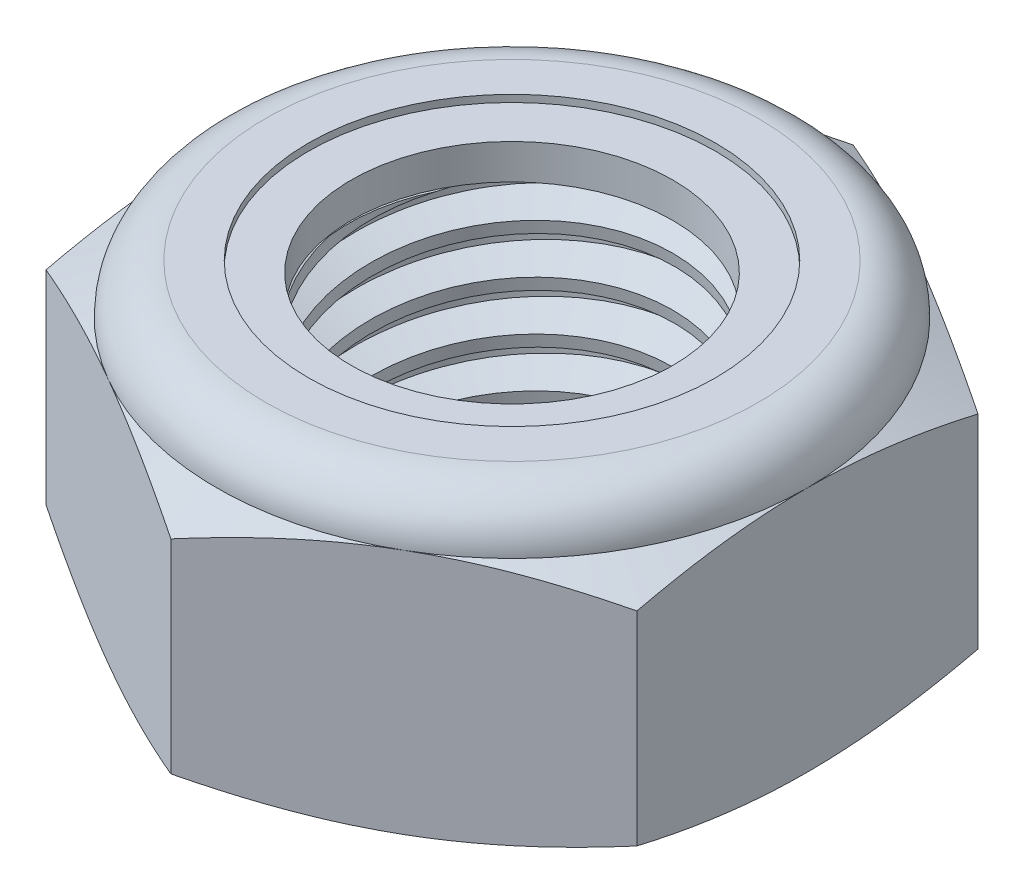
from build123d import *

# Parameters (mm, degrees)
EXTRUDE1_DEPTH      = 6.35
SKETCH2_W           = 3.9624
SKETCH2_H           = 6.35
LPATTERN1_COUNT     = 6
LPATTERN1_PITCH     = 1.058333333
LPATTERN1_COL_COUNT = 2
LPATTERN1_COL_PITCH = 1.058333333


with BuildPart() as part:
    # Sketch1 → Extrude1 (new body)
    with BuildSketch(Plane(origin=(0, 0, 0), x_dir=(1, 0, 0), z_dir=(0, 1, 0))):
        Polygon((0, 7.332348419), (-6.35, 3.666174209), (-6.35, -3.666174209), (0, -7.332348419), (6.35, -3.666174209), (6.35, 3.666174209), align=None)
    extrude(amount=EXTRUDE1_DEPTH)

    # Sketch4 → Cut-Revolve2 (revolve, cut)
    with BuildSketch(Plane(origin=(0, 0, 0), x_dir=(0, 0, -1), z_dir=(1, 0, 0)), mode=Mode.PRIVATE) as cut_revolve2_sk:
        Polygon((0, 6.35), (3.9624, 6.35), (3.4558921, 6.113811487), (3.4558921, 0.236188513), (3.9624, 0), (0, 0), align=None)
    revolve(cut_revolve2_sk.sketch.rotate(Axis((0, 6.35, 0), (0, 1, 0)), 54.857993794), axis=Axis((0, 6.35, 0), (0, 1, 0)), mode=Mode.SUBTRACT)


with BuildPart() as body_2:
    # Sketch2 → Revolve1 (revolve)
    with BuildSketch(Plane(origin=(0, 0, 0), x_dir=(0, 0, -1), z_dir=(1, 0, 0))):
        with Locations((1.9812, 3.175)):
            Rectangle(SKETCH2_W, SKETCH2_H)
    revolve(axis=Axis((0, -3.9624, 0), (0, 1, 0)))

    # Sketch3 → Cut-Revolve1 (revolve, cut)
    with BuildSketch(Plane(origin=(0, 0, 0), x_dir=(0, 0, -1), z_dir=(1, 0, 0)), mode=Mode.PRIVATE) as cut_revolve1_sk:
        Polygon((3.979911688, 6.218872482), (4.102493502, 5.300979859), (3.490915476, 5.552970821), (3.4558921, 5.815225856), align=None)
    cut_revolve1 = revolve(cut_revolve1_sk.sketch.rotate(Axis((0, 6.35, 0.150876649), (0, -0.9912001327823777, -0.1323718126044845)), 180), axis=Axis((0, 6.35, 0.150876649), (0, -0.9912001327823777, -0.1323718126044845)), mode=Mode.SUBTRACT)

    # LPattern1: Cut-Revolve1 ×6
    with Locations(*[(0, -i * LPATTERN1_PITCH, 0) for i in range(1, LPATTERN1_COUNT)]):
        add(cut_revolve1, mode=Mode.SUBTRACT)

    # LPattern1 col: Cut-Revolve1 ×2
    with Locations(*[(0, i * LPATTERN1_COL_PITCH, 0) for i in range(1, LPATTERN1_COL_COUNT)]):
        add(cut_revolve1, mode=Mode.SUBTRACT)


with BuildPart() as part_1:
    add(part.part)

    # Combine1: cut body 2
    add(body_2.part, mode=Mode.SUBTRACT)

    # Sketch5 → Cut-Revolve3 (revolve, cut)
    with BuildSketch(Plane(origin=(0, 0, 0), x_dir=(0, 0, -1), z_dir=(1, 0, 0)), mode=Mode.PRIVATE) as cut_revolve3_sk:
        with BuildLine():
            Line((0, 0), (6.35, 0))
            Line((6.35, 0), (7.332348419, 0.458076591))
            Line((7.332348419, 0.458076591), (7.332348419, 4.833590076))
            Line((7.332348419, 4.833590076), (6.35, 5.291666667))
            ThreePointArc((6.35, 5.291666667), (6.040021343, 6.040021343), (5.291666667, 6.35))
            Line((5.291666667, 6.35), (5.291666667, 7.62))
            Line((5.291666667, 7.62), (8.602348419, 7.62))
            Line((8.602348419, 7.62), (8.602348419, -1.27))
            Line((8.602348419, -1.27), (0, -1.27))
            Line((0, -1.27), (0, 0))
        make_face()
    revolve(cut_revolve3_sk.sketch.rotate(Axis((0, 0, 0), (0, 1, 0)), 54.867789329), axis=Axis((0, 0, 0), (0, 1, 0)), mode=Mode.SUBTRACT)

    # Sketch6 → Cut-Revolve4 (revolve, cut)
    with BuildSketch(Plane(origin=(0, 0, 0), x_dir=(0, 0, -1), z_dir=(1, 0, 0)), mode=Mode.PRIVATE) as cut_revolve4_sk:
        with BuildLine():
            Line((0, 5.291666667), (6.1976, 5.291666667))
            ThreePointArc((6.1976, 5.291666667), (5.93225827, 5.93225827), (5.291666667, 6.1976))
            Line((5.291666667, 6.1976), (4.373779383, 6.1976))
            Line((4.373779383, 6.1976), (4.373779383, 7.62))
            Line((4.373779383, 7.62), (0, 7.62))
            Line((0, 7.62), (0, 5.291666667))
        make_face()
    revolve(cut_revolve4_sk.sketch.rotate(Axis((0, 7.62, 0), (0, 1, 0)), 54.857993794), axis=Axis((0, 7.62, 0), (0, 1, 0)), mode=Mode.SUBTRACT)


with BuildPart() as body_2_2:
    # Sketch7 → Revolve2 (revolve)
    with BuildSketch(Plane(origin=(0, 0, 0), x_dir=(0, 0, -1), z_dir=(1, 0, 0))):
        with BuildLine():
            Line((3.4558921, 5.367866667), (6.117893612, 5.367866667))
            ThreePointArc((6.117893612, 5.367866667), (5.850787282, 5.904725834), (5.291666667, 6.1214))
            Line((5.291666667, 6.1214), (3.4558921, 6.1214))
            Line((3.4558921, 6.1214), (3.4558921, 5.367866667))
        make_face()
    revolve(axis=Axis((0, 5.367866667, 0), (0, 1, 0)))


solid = Compound([part_1.part, body_2_2.part])
